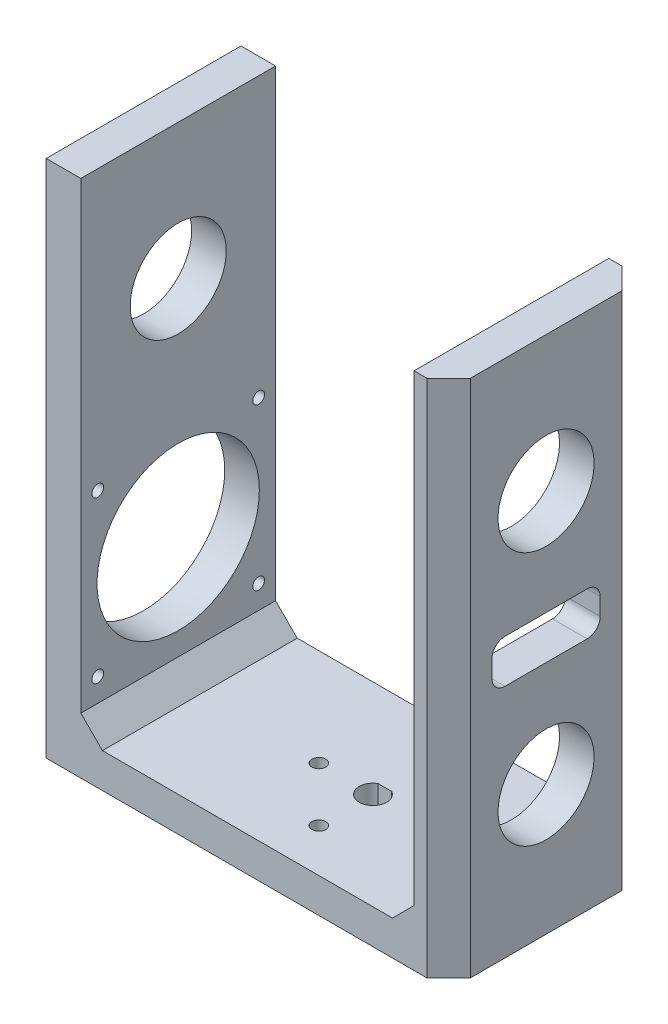
from build123d import *

# Parameters (mm, degrees)
SKETCH1_W               = 93
SKETCH1_H               = 130
SKETCH1_W_2             = 77
SKETCH1_H_2             = 114
BOSS_EXTRUDE1_DEPTH     = 22.5
CUT_EXTRUDE1_START      = 32
SKETCH2_R               = 11.1
CUT_EXTRUDE1_DEPTH      = 111.180343226
CUT_EXTRUDE2_START      = -45
SKETCH3_R               = 11.1
SKETCH3_R_2             = 18.75
CUT_EXTRUDE2_DEPTH      = 98.180343226
CUT_EXTRUDE3_DEPTH      = 143.180343226
CUT_EXTRUDE3_DEPTH_BACK = 143.180343226
SKETCH4_R               = 1.6
CUT_EXTRUDE4_START      = -45
SKETCH5_R               = 1.35
CUT_EXTRUDE4_DEPTH      = 98.180343226
CHAMFER1_SIZE           = 5
CUT_EXTRUDE5_DEPTH      = 143.180343226
CUT_EXTRUDE5_DEPTH_BACK = 143.180343226
SKETCH6_W               = 106
SKETCH6_H               = 10
CHAMFER2_SIZE           = 5
SKETCH11_W              = 25
SKETCH11_H              = 10
CUT_EXTRUDE7_DEPTH      = 134.098647626
FILLET2_R               = 3


with BuildPart() as part:
    # Sketch1 → Boss-Extrude1 (new, symmetric)
    with BuildSketch(Plane.XY):
        with Locations((-6.5, 65)):
            Rectangle(SKETCH1_W, SKETCH1_H)
        with Locations((-6.5, 65)):
            Rectangle(SKETCH1_W_2, SKETCH1_H_2, mode=Mode.SUBTRACT)
    extrude(amount=BOSS_EXTRUDE1_DEPTH, both=True)

    # Sketch2 → Cut-Extrude1 (cut, through all)
    with BuildSketch(Plane(origin=(0, 0, 0), x_dir=(0, 0, -1), z_dir=(1, 0, 0)).offset(CUT_EXTRUDE1_START)):
        with Locations(Location((0, 88.73, 0), (0, 0, 180))):
            Circle(SKETCH2_R)
        with Locations(Location((0, 30, 0), (0, 0, 180))):
            Circle(SKETCH2_R)
    extrude(amount=CUT_EXTRUDE1_DEPTH, mode=Mode.SUBTRACT)

    # Sketch3 → Cut-Extrude2 (cut, through all)
    with BuildSketch(Plane(origin=(0, 0, 0), x_dir=(0, 0, -1), z_dir=(1, 0, 0)).offset(CUT_EXTRUDE2_START)):
        with Locations(Location((0, 88.73, 0), (0, 0, 180))):
            Circle(SKETCH3_R)
        with Locations((0, 37)):
            Circle(SKETCH3_R_2)
    extrude(amount=-CUT_EXTRUDE2_DEPTH, mode=Mode.SUBTRACT)

    # Sketch4 → Cut-Extrude3 (cut, two sides: drawn at the far end of the back side and taken through both)
    with BuildSketch(Plane(origin=(0, 0, 0), x_dir=(1, 0, 0), z_dir=(0, 1, 0)).offset(-CUT_EXTRUDE3_DEPTH_BACK)):
        with Locations(Location((-12.5, 0, 0), (0, 0, 270))):
            Circle(SKETCH4_R)
        with Locations(Location((0, 12.5, 0), (0, 0, 270))):
            Circle(SKETCH4_R)
        with Locations(Location((12.5, 0, 0), (0, 0, 270))):
            Circle(SKETCH4_R)
        with Locations(Location((0, -12.5, 0), (0, 0, 270))):
            Circle(SKETCH4_R)
        with BuildLine():
            Line((-1.5875, 2.749630657), (1.5875, 2.749630657))
            ThreePointArc((1.5875, 2.749630657), (0, -3.175), (-1.5875, 2.749630657))
        make_face()
    extrude(amount=CUT_EXTRUDE3_DEPTH + CUT_EXTRUDE3_DEPTH_BACK, mode=Mode.SUBTRACT)

    # Sketch5 → Cut-Extrude4 (cut, through all)
    with BuildSketch(Plane(origin=(0, 0, 0), x_dir=(0, 0, -1), z_dir=(1, 0, 0)).offset(CUT_EXTRUDE4_START)):
        with Locations((18.589603123, 18.410396877)):
            Circle(SKETCH5_R)
        with Locations((-18.589603123, 18.410396877)):
            Circle(SKETCH5_R)
        with Locations((-18.589603123, 55.589603123)):
            Circle(SKETCH5_R)
        with Locations((18.589603123, 55.589603123)):
            Circle(SKETCH5_R)
    extrude(amount=-CUT_EXTRUDE4_DEPTH, mode=Mode.SUBTRACT)

    # Chamfer1
    chamfer1_edges = [part.edges().sort_by_distance(p)[0] for p in [
        (40, 65, 22.5),
        (40, 65, -22.5),
    ]]
    chamfer(chamfer1_edges, length=CHAMFER1_SIZE)

    # Sketch6 → Cut-Extrude5 (cut, two sides: drawn at the far end of the back side and taken through both)
    with BuildSketch(Plane.XY.offset(-CUT_EXTRUDE5_DEPTH_BACK)):
        with Locations((0, 125)):
            Rectangle(SKETCH6_W, SKETCH6_H)
    extrude(amount=CUT_EXTRUDE5_DEPTH + CUT_EXTRUDE5_DEPTH_BACK, mode=Mode.SUBTRACT)

    # Chamfer2
    chamfer2_edges = [part.edges().sort_by_distance(p)[0] for p in [
        (-45, 8, 0),
        (32, 8, 0),
    ]]
    chamfer(chamfer2_edges, length=CHAMFER2_SIZE)

    # Sketch11 → Cut-Extrude7 (cut, through all)
    with BuildSketch(Plane(origin=(0, 0, 0), x_dir=(0, 0, -1), z_dir=(1, 0, 0))):
        with Locations((0, 59.365)):
            Rectangle(SKETCH11_W, SKETCH11_H)
    extrude(amount=CUT_EXTRUDE7_DEPTH, mode=Mode.SUBTRACT)

    # Fillet2
    fillet2_edges = [part.edges().sort_by_distance(p)[0] for p in [
        (36, 54.365, -12.5),
        (36, 64.365, -12.5),
        (36, 64.365, 12.5),
        (36, 54.365, 12.5),
    ]]
    fillet(fillet2_edges, radius=FILLET2_R)


solid = part.part
